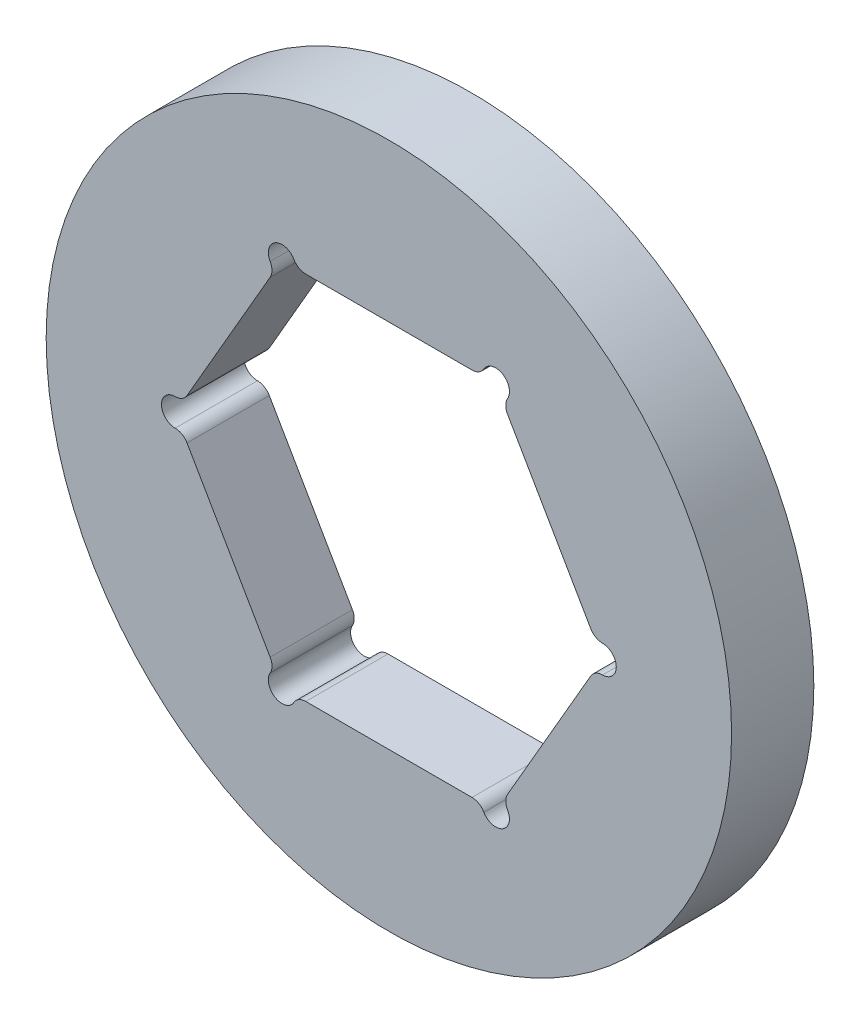
from build123d import *

# Parameters (mm, degrees)
SKETCH1_R           = 25
BOSS_EXTRUDE1_DEPTH = 3
SKETCH2_R           = 1
CUT_EXTRUDE1_DEPTH  = 36.860842154
FILLET1_R           = 1


with BuildPart() as part:
    # Sketch1 → Boss-Extrude1 (new, symmetric)
    with BuildSketch(Plane.XY):
        Circle(SKETCH1_R)
        Polygon((-15.588457268, 0), (-7.794228634, -13.5), (7.794228634, -13.5), (15.588457268, 0), (7.794228634, 13.5), (-7.794228634, 13.5), align=None, mode=Mode.SUBTRACT)
    extrude(amount=BOSS_EXTRUDE1_DEPTH, both=True)

    # Sketch2 → Cut-Extrude1 (cut, through all)
    with BuildSketch(Plane.XY.offset(3)):
        with Locations((-7.794228634, 13.5)):
            Circle(SKETCH2_R)
        with Locations((7.794228634, 13.5)):
            Circle(SKETCH2_R)
        with Locations((-15.588457268, 0)):
            Circle(SKETCH2_R)
        with Locations((-7.794228634, -13.5)):
            Circle(SKETCH2_R)
        with Locations((7.794228634, -13.5)):
            Circle(SKETCH2_R)
        with Locations((15.588457268, 0)):
            Circle(SKETCH2_R)
    extrude(amount=-CUT_EXTRUDE1_DEPTH, mode=Mode.SUBTRACT)

    # Fillet1
    fillet1_edges = [part.edges().sort_by_distance(p)[0] for p in [
        (-6.794228634, 13.5, 0),
        (6.794228634, 13.5, 0),
        (15.088457268, 0.866025404, 0),
        (8.294228634, -12.633974596, 0),
        (-6.794228634, -13.5, 0),
        (-15.088457268, -0.866025404, 0),
        (15.088457268, -0.866025404, 0),
        (6.794228634, -13.5, 0),
        (-8.294228634, -12.633974596, 0),
        (-15.088457268, 0.866025404, 0),
        (8.294228634, 12.633974596, 0),
        (-8.294228634, 12.633974596, 0),
    ]]
    fillet(fillet1_edges, radius=FILLET1_R)


solid = part.part
